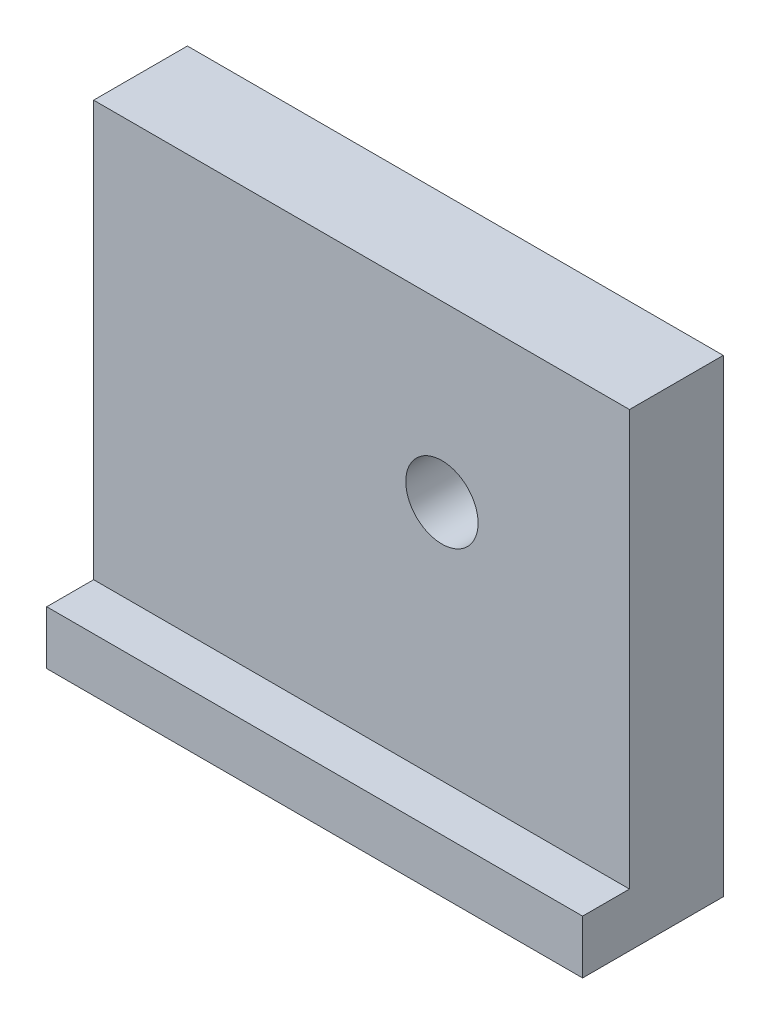
from build123d import *

# Parameters (mm, degrees)
SKETCH_1_W      = 40
SKETCH_1_H      = 35
SKETCH_1_R      = 2.7
EXTRUDE_1_DEPTH = 3.5
SKETCH_2_W      = 40
SKETCH_2_H      = 4
EXTRUDE_2_DEPTH = 7


with BuildPart() as part:
    # 草图1 → 凸台-拉伸1 (new, symmetric)
    with BuildSketch(Plane.XY):
        with Locations((0, 17.5)):
            Rectangle(SKETCH_1_W, SKETCH_1_H)
        with Locations((6, 22)):
            Circle(SKETCH_1_R, mode=Mode.SUBTRACT)
    extrude(amount=EXTRUDE_1_DEPTH, both=True)

    # 草图2 → 凸台-拉伸2 (add)
    with BuildSketch(Plane.XY):
        with Locations((0, 2)):
            Rectangle(SKETCH_2_W, SKETCH_2_H)
    extrude(amount=EXTRUDE_2_DEPTH)


solid = part.part
